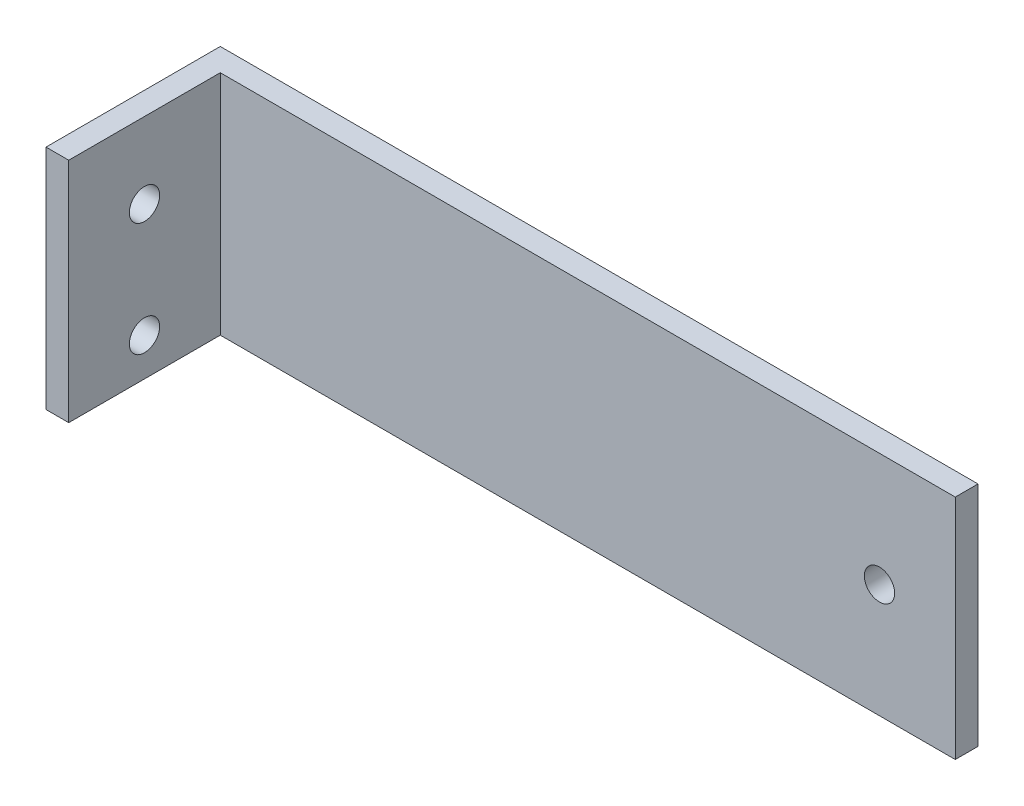
from build123d import *

# Parameters (mm, degrees)
SKETCH1_W           = 100
SKETCH1_H           = 30
BOSS_EXTRUDE1_DEPTH = 3
SKETCH2_W           = 3
SKETCH2_H           = 30
BOSS_EXTRUDE2_DEPTH = 20
SKETCH3_R           = 2
CUT_EXTRUDE1_DEPTH  = 104.701494685
SKETCH4_R           = 2
CUT_EXTRUDE2_DEPTH  = 10


with BuildPart() as part:
    # Sketch1 → Boss-Extrude1 (new body)
    with BuildSketch(Plane.XY):
        Rectangle(SKETCH1_W, SKETCH1_H)
    extrude(amount=BOSS_EXTRUDE1_DEPTH)

    # Sketch2 → Boss-Extrude2 (add)
    with BuildSketch(Plane.XY.offset(3)):
        with Locations((-48.5, 0)):
            Rectangle(SKETCH2_W, SKETCH2_H)
    extrude(amount=BOSS_EXTRUDE2_DEPTH)

    # Sketch3 → Cut-Extrude1 (cut, through all)
    with BuildSketch(Plane.ZY.offset(50)):
        with Locations((13, 5)):
            Circle(SKETCH3_R)
        with Locations((13, -10)):
            Circle(SKETCH3_R)
    extrude(amount=-CUT_EXTRUDE1_DEPTH, mode=Mode.SUBTRACT)

    # Sketch4 → Cut-Extrude2 (cut)
    with BuildSketch(Plane(origin=(0, 0, 0), x_dir=(-1, 0, 0), z_dir=(0, 0, -1))):
        with Locations((-40, 0)):
            Circle(SKETCH4_R)
    extrude(amount=-CUT_EXTRUDE2_DEPTH, mode=Mode.SUBTRACT)


solid = part.part
